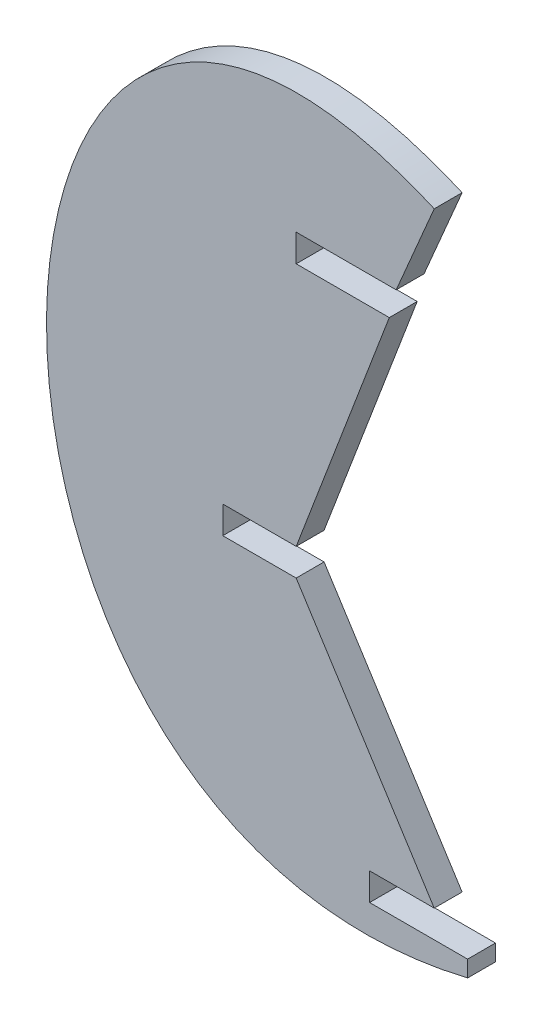
from build123d import *

# Parameters (mm, degrees)
ESTRUSIONE_ESTRUSIONE1_DEPTH = 5.7


with BuildPart() as part:
    # Model → Estrusione-Estrusione1 (new body)
    with BuildSketch(Plane.XY):
        with BuildLine():
            Line((-5, 0.09), (-5, -3.254122143))
            add(Edge.make_bspline(
                [(-5, -3.254122143), (-122.039878304, -31.264583812), (-115.130671173, 174.542277049), (-11.818324795, 129.448781979)],
                knots=[0, 0, 0, 0, 1, 1, 1, 1], degree=3))
            Line((-11.818324795, 129.448781979), (-19.584652517, 111.22))
            Line((-19.584652517, 111.22), (-40.0225, 111.22))
            Line((-40.0225, 111.22), (-40.0225, 105.61))
            Line((-40.0225, 105.61), (-20.998922906, 105.61))
            Line((-20.998922906, 105.61), (-40.0225, 55.61))
            Line((-40.0225, 55.61), (-55.0225, 55.61))
            Line((-55.0225, 55.61), (-55.0225, 50))
            Line((-55.0225, 50), (-40.0225, 50.008559229))
            Line((-40.0225, 50.008559229), (-11.818324795, 5.7))
            Line((-11.818324795, 5.7), (-25.0225, 5.7))
            Line((-25.0225, 5.7), (-25.0225, 0.09))
            Line((-25.0225, 0.09), (-5, 0.09))
        make_face()
    extrude(amount=ESTRUSIONE_ESTRUSIONE1_DEPTH)


solid = part.part
